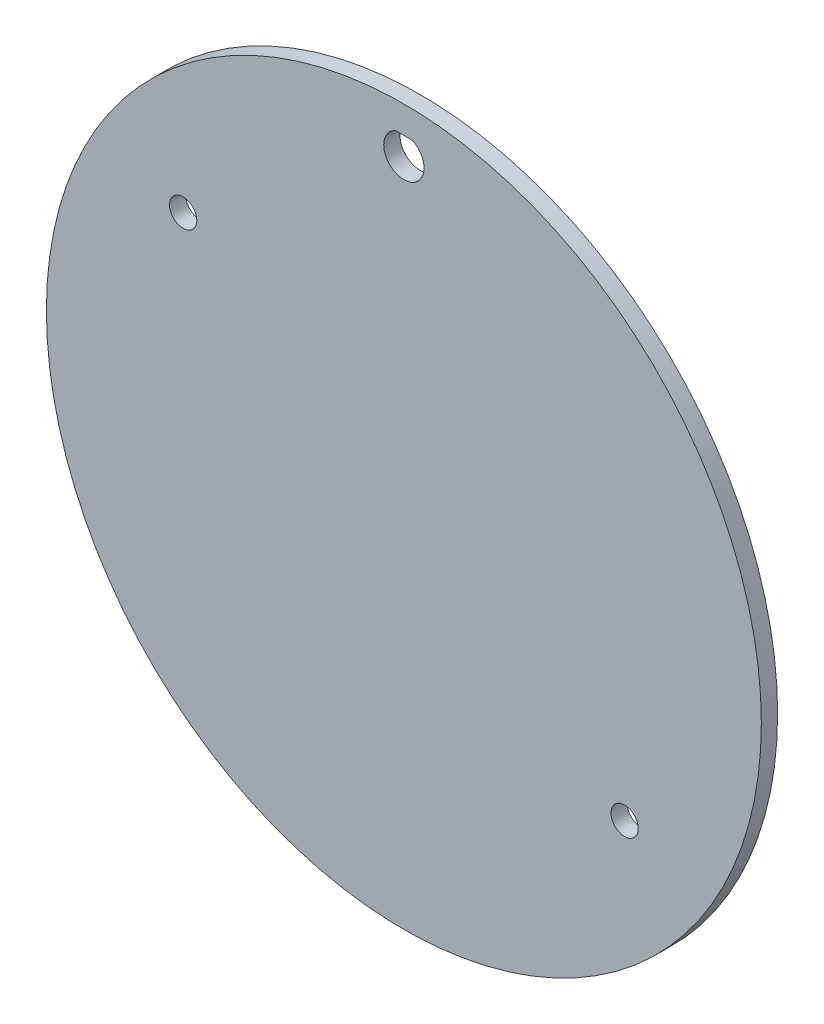
from build123d import *

# Parameters (mm, degrees)
ESQUISSE1_R             = 55
BOSS_EXTRU_1_DEPTH      = 2.5
ESQUISSE2_R             = 2.1
ENL_V_MAT_EXTRU_1_DEPTH = 78.821912081
ENL_V_MAT_EXTRU_2_DEPTH = 10


with BuildPart() as part:
    # Esquisse1 → Boss.-Extru.1 (new body)
    with BuildSketch(Plane.XY):
        Circle(ESQUISSE1_R)
    extrude(amount=BOSS_EXTRU_1_DEPTH)

    # Esquisse2 → Enlèv. mat.-Extru.1 (cut, through all)
    with BuildSketch(Plane.XY.offset(2.5)):
        with Locations((33.959943273, -23.5374475)):
            Circle(ESQUISSE2_R)
        with Locations((-33.959943273, 23.5374475)):
            Circle(ESQUISSE2_R)
    extrude(amount=-ENL_V_MAT_EXTRU_1_DEPTH, mode=Mode.SUBTRACT)

    # Esquisse3 → Enlèv. mat.-Extru.2 (cut)
    with BuildSketch(Plane.XY.offset(2.5)):
        with BuildLine():
            Line((1.33041347, 50.8), (-1.33041347, 50.8))
            ThreePointArc((-1.33041347, 50.8), (0, 44.9), (1.33041347, 50.8))
        make_face()
    extrude(amount=-ENL_V_MAT_EXTRU_2_DEPTH, mode=Mode.SUBTRACT)


solid = part.part
